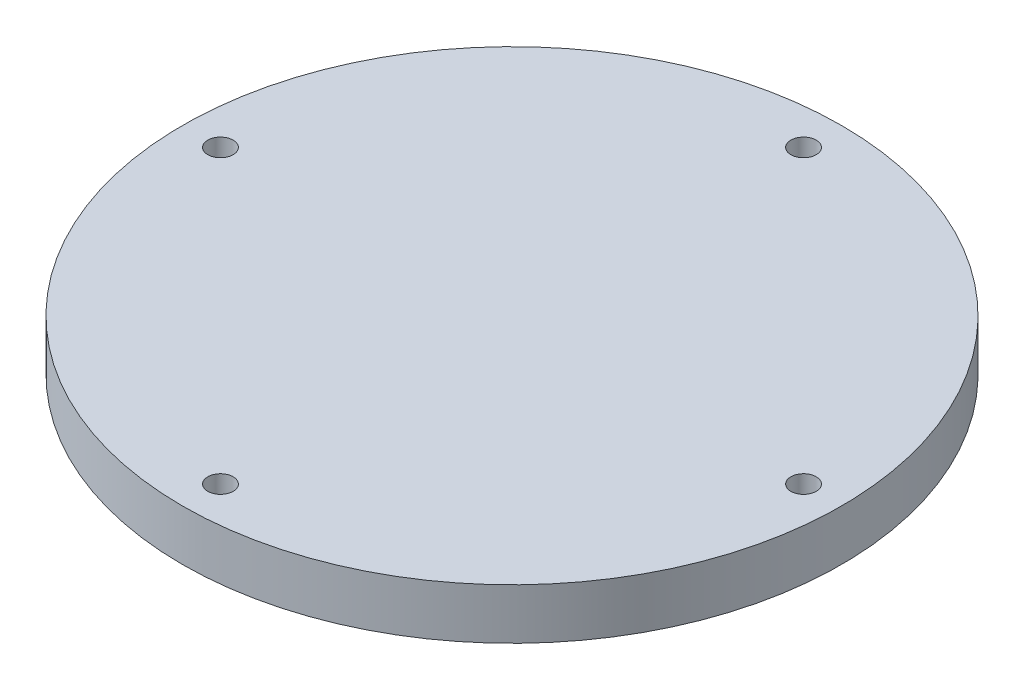
from build123d import *

# Parameters (mm, degrees)
SKETCH1_R           = 65
BOSS_EXTRUDE1_DEPTH = 10
SKETCH2_R           = 2.5
CUT_EXTRUDE1_DEPTH  = 93.466210045


with BuildPart() as part:
    # Sketch1 → Boss-Extrude1 (new body)
    with BuildSketch(Plane(origin=(0, 0, 0), x_dir=(1, 0, 0), z_dir=(0, 1, 0))):
        with Locations(Location((0, 0, 0), (0, 0, 270))):
            Circle(SKETCH1_R)
    extrude(amount=BOSS_EXTRUDE1_DEPTH)

    # Sketch2 → Cut-Extrude1 (cut, through all)
    with BuildSketch(Plane(origin=(0, 10, 0), x_dir=(1, 0, 0), z_dir=(0, 1, 0))):
        with Locations(Location((0, 57.5, 0), (0, 0, 270))):
            Circle(SKETCH2_R)
        with Locations(Location((57.5, 0, 0), (0, 0, 270))):
            Circle(SKETCH2_R)
        with Locations(Location((0, -57.5, 0), (0, 0, 270))):
            Circle(SKETCH2_R)
        with Locations(Location((-57.5, 0, 0), (0, 0, 270))):
            Circle(SKETCH2_R)
    extrude(amount=-CUT_EXTRUDE1_DEPTH, mode=Mode.SUBTRACT)


solid = part.part
